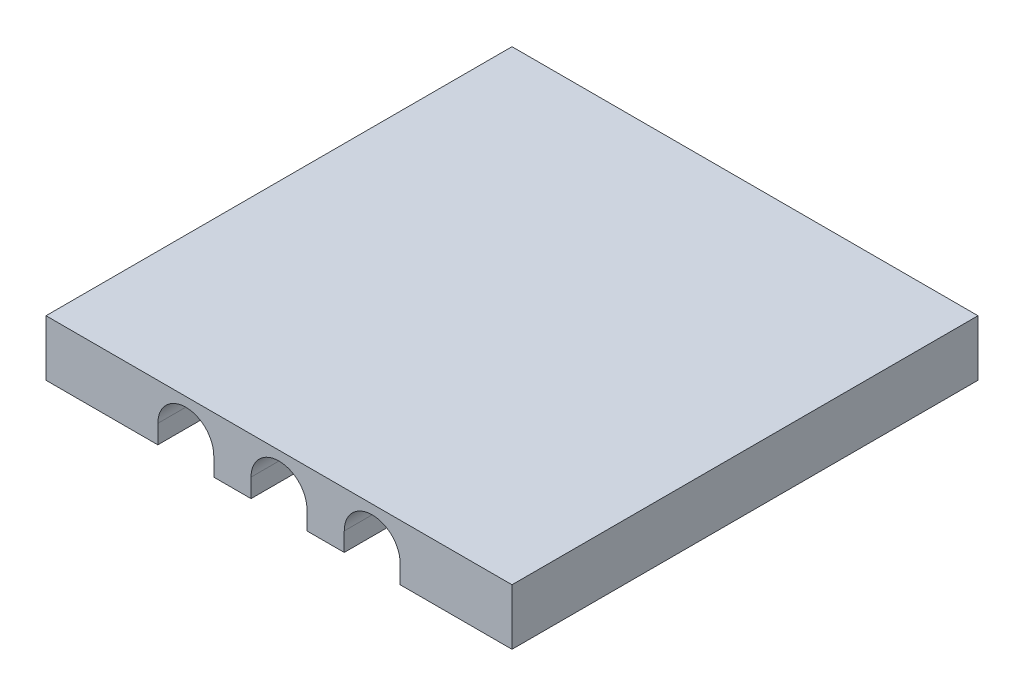
from build123d import *

# Parameters (mm, degrees)
SKETCH_1_W                 = 50
SKETCH_1_H                 = 6
EXTRUDE_1_DEPTH            = 25
CUT_EXTRUDE_1_REACH        = 57.982
PATTERN_LINEAR_1_COUNT     = 2
PATTERN_LINEAR_1_PITCH     = 10
PATTERN_LINEAR_1_COL_COUNT = 2
PATTERN_LINEAR_1_COL_PITCH = 10


with BuildPart() as part:
    # 草图1 → 凸台-拉伸1 (new, symmetric)
    with BuildSketch(Plane.XY):
        Rectangle(SKETCH_1_W, SKETCH_1_H)
    extrude(amount=EXTRUDE_1_DEPTH, both=True)

    # 草图2 → 切除-拉伸1 (cut, up to next)
    with BuildSketch(Plane.XY.offset(25), mode=Mode.PRIVATE) as cut_extrude_1_sk1:
        with BuildLine():
            Line((-3, -1), (-3, -3))
            Line((-3, -3), (3, -3))
            Line((3, -3), (3, -1))
            ThreePointArc((3, -1), (0, 2), (-3, -1))
        make_face()
    cut_extrude_1_tool1 = extrude(cut_extrude_1_sk1.sketch, amount=-CUT_EXTRUDE_1_REACH, mode=Mode.PRIVATE) & part.part
    cut_extrude_1 = cut_extrude_1_tool1.solids().sort_by_distance((0, -0.770442, 25))[0]
    add(cut_extrude_1, mode=Mode.SUBTRACT)

    # 阵列(线性)1: 切除-拉伸1 ×2
    with Locations(*[(-i * PATTERN_LINEAR_1_PITCH, 0, 0) for i in range(1, PATTERN_LINEAR_1_COUNT)]):
        add(cut_extrude_1, mode=Mode.SUBTRACT)

    # 阵列(线性)1 col: 切除-拉伸1 ×2
    with Locations(*[(i * PATTERN_LINEAR_1_COL_PITCH, 0, 0) for i in range(1, PATTERN_LINEAR_1_COL_COUNT)]):
        add(cut_extrude_1, mode=Mode.SUBTRACT)


solid = part.part
